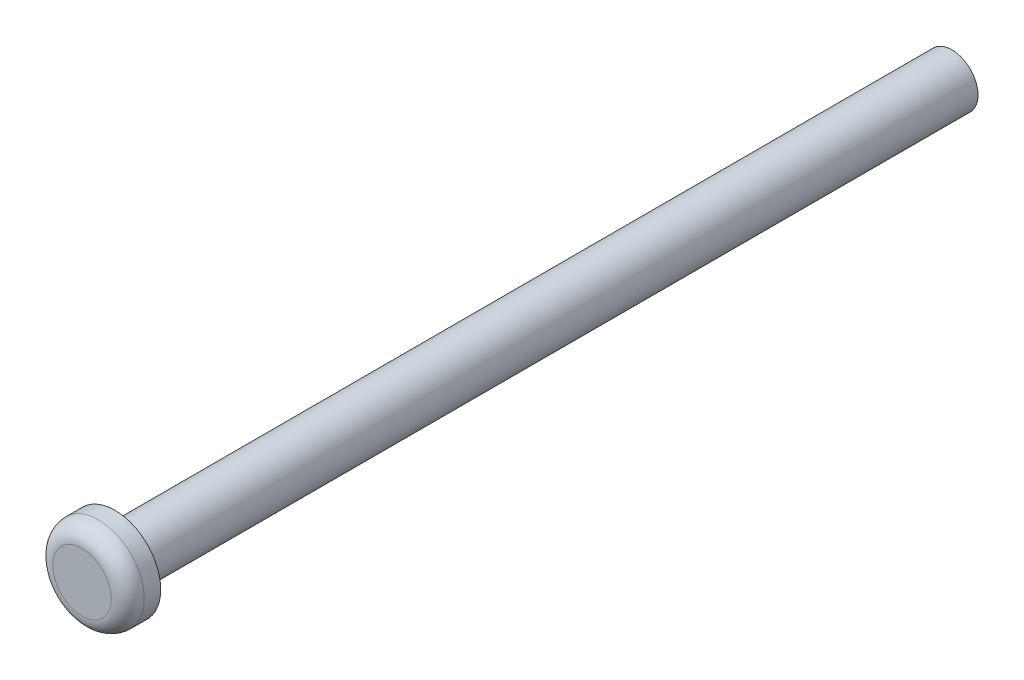
from build123d import *

# Parameters (mm, degrees)
SKETCH1_R         = 3.175
SCREWLENGTH_DEPTH = 101.6
SKETCH2_R         = 5.55625
HEAD_DEPTH        = 4
FILLET4_R         = 2


with BuildPart() as part:
    # Sketch1 → Screwlength (new body)
    with BuildSketch(Plane.XY):
        Circle(SKETCH1_R)
    extrude(amount=-SCREWLENGTH_DEPTH)

    # Sketch2 → Head (add)
    with BuildSketch(Plane.XY):
        Circle(SKETCH2_R)
    extrude(amount=HEAD_DEPTH)

    # Fillet4
    fillet4_edges = [part.edges().sort_by_distance(p)[0] for p in [
        (-5.55625, 0, 4),
    ]]
    fillet(fillet4_edges, radius=FILLET4_R)


solid = part.part
